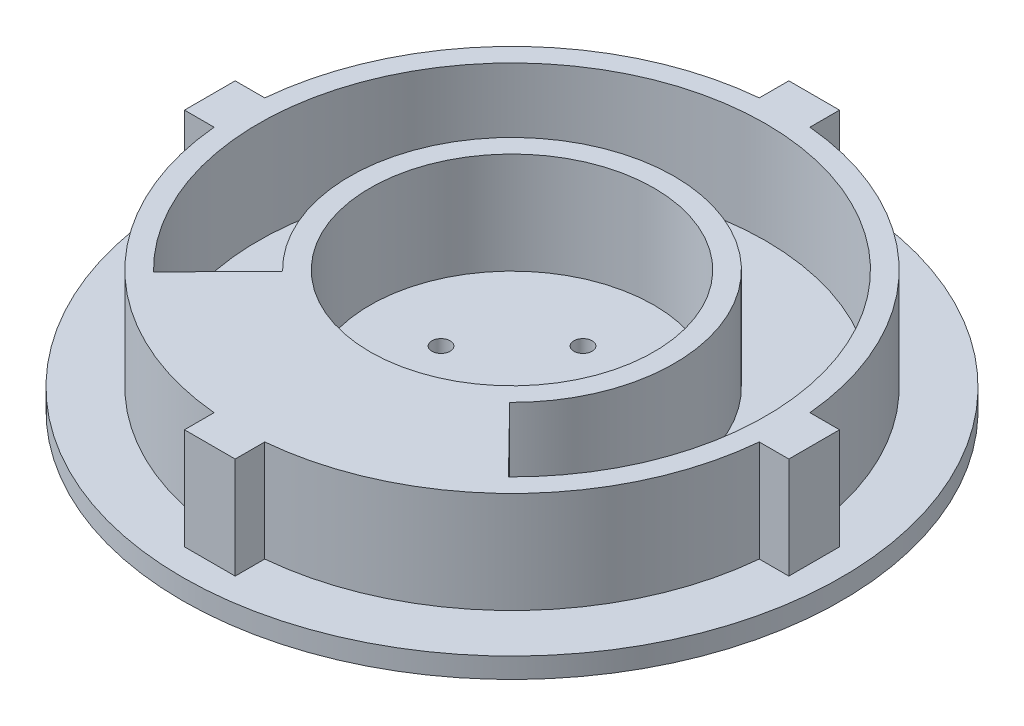
from build123d import *

# Parameters (mm, degrees)
SKETCH1_R           = 27
SKETCH1_R_2         = 14
BOSS_EXTRUDE1_DEPTH = 10
SKETCH2_R           = 32.5
BOSS_EXTRUDE2_DEPTH = 2
SKETCH3_W           = 5
SKETCH3_H           = 4.39677325
SKETCH3_W_2         = 4.39677325
SKETCH3_H_2         = 5
BOSS_EXTRUDE3_DEPTH = 10
CUT_EXTRUDE1_REACH  = 49.503
SKETCH4_R           = 0.9


with BuildPart() as part:
    # Sketch1 → Boss-Extrude1 (new body)
    with BuildSketch(Plane(origin=(0, 0, 0), x_dir=(1, 0, 0), z_dir=(0, 1, 0))):
        with Locations(Location((0, 0, 0), (0, 0, 270))):
            Circle(SKETCH1_R)
        with Locations(Location((0, 0, 0), (0, 0, 270))):
            Circle(SKETCH1_R_2, mode=Mode.SUBTRACT)
        with BuildLine():
            Line((-17.5, -17.853571071), (-11.2, -11.426285486))
            ThreePointArc((-11.2, -11.426285486), (0, 16), (11.2, -11.426285486))
            Line((11.2, -11.426285486), (17.5, -17.853571071))
            ThreePointArc((17.5, -17.853571071), (0, 25), (-17.5, -17.853571071))
        make_face(mode=Mode.SUBTRACT)
    extrude(amount=BOSS_EXTRUDE1_DEPTH)

    # Sketch2 → Boss-Extrude2 (add)
    with BuildSketch(Plane.XZ):
        with Locations(Location((0, 0, 0), (0, 0, 270))):
            Circle(SKETCH2_R)
    extrude(amount=BOSS_EXTRUDE2_DEPTH)

    # Sketch3 → Boss-Extrude3 (add)
    with BuildSketch(Plane(origin=(0, 0, 0), x_dir=(1, 0, 0), z_dir=(0, 1, 0))):
        with Locations((0, 27.601613375)):
            Rectangle(SKETCH3_W, SKETCH3_H)
        with Locations((27.601613375, 0)):
            Rectangle(SKETCH3_W_2, SKETCH3_H_2)
        with Locations((0, -27.601613375)):
            Rectangle(SKETCH3_W, SKETCH3_H)
        with Locations((-27.601613375, 0)):
            Rectangle(SKETCH3_W_2, SKETCH3_H_2)
    extrude(amount=BOSS_EXTRUDE3_DEPTH)

    # Sketch4 → Cut-Extrude1 (cut, up to next)
    with BuildSketch(Plane.XZ.offset(2), mode=Mode.PRIVATE) as cut_extrude1_sk1:
        with Locations(Location((0, -7, 0), (0, 0, 270))):
            Circle(SKETCH4_R)
    cut_extrude1_tool1 = extrude(cut_extrude1_sk1.sketch, amount=-CUT_EXTRUDE1_REACH, mode=Mode.PRIVATE) & part.part
    # Sketch4 → Cut-Extrude1 (cut, up to next)
    with BuildSketch(Plane.XZ.offset(2), mode=Mode.PRIVATE) as cut_extrude1_sk2:
        with Locations(Location((-7, 0, 0), (0, 0, 270))):
            Circle(SKETCH4_R)
    cut_extrude1_tool2 = extrude(cut_extrude1_sk2.sketch, amount=-CUT_EXTRUDE1_REACH, mode=Mode.PRIVATE) & part.part
    # Sketch4 → Cut-Extrude1 (cut, up to next)
    with BuildSketch(Plane.XZ.offset(2), mode=Mode.PRIVATE) as cut_extrude1_sk3:
        with Locations(Location((0, 7, 0), (0, 0, 270))):
            Circle(SKETCH4_R)
    cut_extrude1_tool3 = extrude(cut_extrude1_sk3.sketch, amount=-CUT_EXTRUDE1_REACH, mode=Mode.PRIVATE) & part.part
    # Sketch4 → Cut-Extrude1 (cut, up to next)
    with BuildSketch(Plane.XZ.offset(2), mode=Mode.PRIVATE) as cut_extrude1_sk4:
        with Locations(Location((7, 0, 0), (0, 0, 270))):
            Circle(SKETCH4_R)
    cut_extrude1_tool4 = extrude(cut_extrude1_sk4.sketch, amount=-CUT_EXTRUDE1_REACH, mode=Mode.PRIVATE) & part.part
    add(cut_extrude1_tool1.solids().sort_by_distance((0, -2, -7))[0], mode=Mode.SUBTRACT)
    add(cut_extrude1_tool2.solids().sort_by_distance((-7, -2, 0))[0], mode=Mode.SUBTRACT)
    add(cut_extrude1_tool3.solids().sort_by_distance((0, -2, 7))[0], mode=Mode.SUBTRACT)
    add(cut_extrude1_tool4.solids().sort_by_distance((7, -2, 0))[0], mode=Mode.SUBTRACT)


solid = part.part
